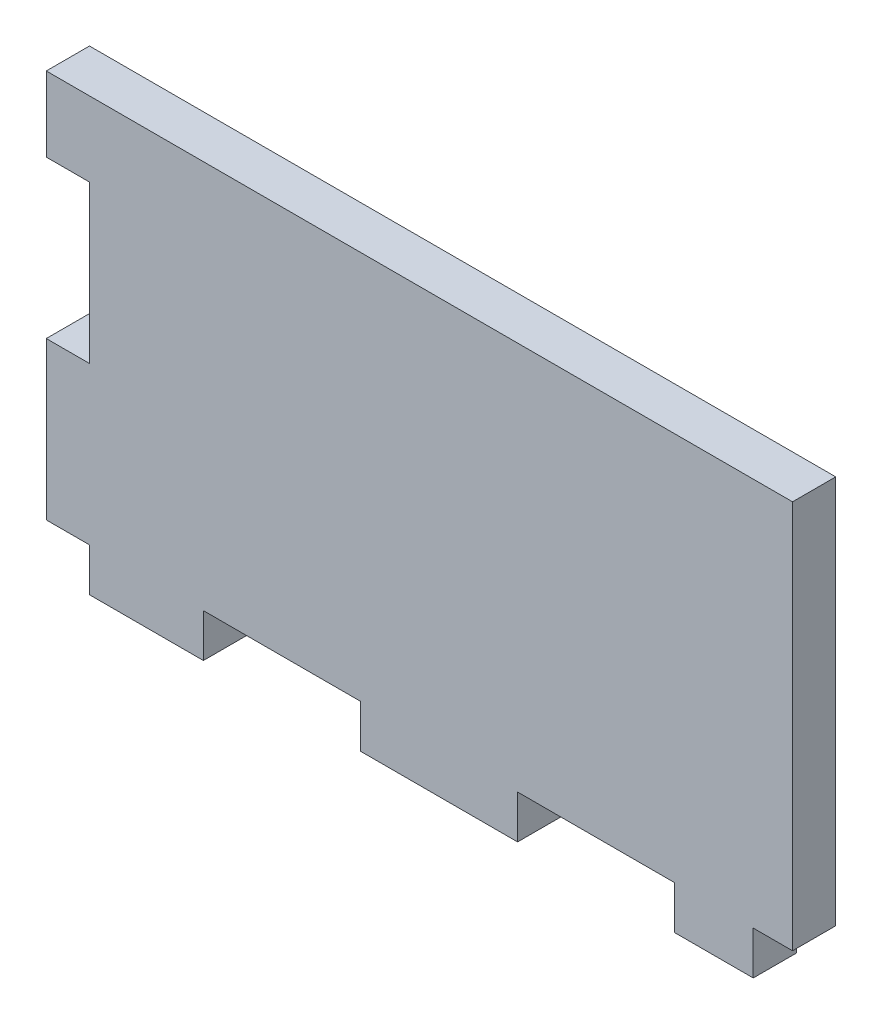
from build123d import *

# Parameters (mm, degrees)
SKETCH_1_W          = 95
SKETCH_1_H          = 55
EXTRUDE_1_DEPTH     = 5.5
SKETCH_3_W          = 5.5
SKETCH_3_H          = 20
CUT_EXTRUDE_2_DEPTH = 56.161127617
SKETCH_4_W          = 20
SKETCH_4_H          = 5.504098133
SKETCH_4_W_2        = 5
CUT_EXTRUDE_3_DEPTH = 56.161127617


with BuildPart() as part:
    # ｽｹｯﾁ1 → ﾎﾞｽ - 押し出し1 (new body)
    with BuildSketch(Plane.XY):
        Rectangle(SKETCH_1_W, SKETCH_1_H)
    extrude(amount=EXTRUDE_1_DEPTH)

    # ｽｹｯﾁ3 → ｶｯﾄ - 押し出し2 (cut, through all)
    with BuildSketch(Plane.XY.offset(5.5)):
        with Locations((-44.75, -32)):
            Rectangle(SKETCH_3_W, SKETCH_3_H)
        with Locations((-44.75, 8)):
            Rectangle(SKETCH_3_W, SKETCH_3_H)
    extrude(amount=-CUT_EXTRUDE_2_DEPTH, mode=Mode.SUBTRACT)

    # ｽｹｯﾁ4 → ｶｯﾄ - 押し出し3 (cut, through all)
    with BuildSketch(Plane.XY.offset(5.5)):
        with Locations((-17.5, -24.747950934)):
            Rectangle(SKETCH_4_W, SKETCH_4_H)
        with Locations((22.5, -24.747950934)):
            Rectangle(SKETCH_4_W, SKETCH_4_H)
        with Locations((45, -24.747950934)):
            Rectangle(SKETCH_4_W_2, SKETCH_4_H)
    extrude(amount=-CUT_EXTRUDE_3_DEPTH, mode=Mode.SUBTRACT)


solid = part.part
